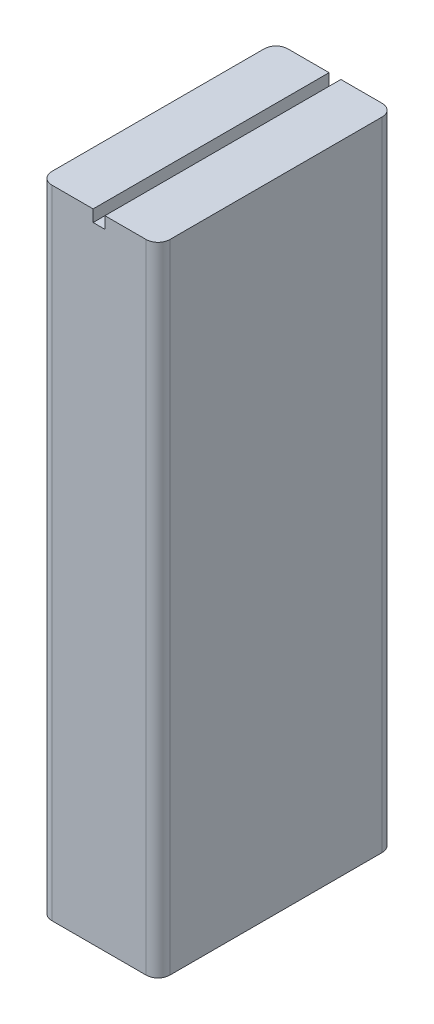
from build123d import *

# Parameters (mm, degrees)
SKETCH_1_W          = 10
SKETCH_1_H          = 20
EXTRUDE_1_DEPTH     = 54
FILLET_1_R          = 1
SKETCH_2_W          = 1
SKETCH_2_H          = 20
CUT_EXTRUDE_1_DEPTH = 1


with BuildPart() as part:
    # 草图1 → 凸台-拉伸1 (new body)
    with BuildSketch(Plane(origin=(0, 0, 0), x_dir=(1, 0, 0), z_dir=(0, 1, 0))):
        with Locations((5, 10)):
            Rectangle(SKETCH_1_W, SKETCH_1_H)
    extrude(amount=EXTRUDE_1_DEPTH)

    # 圆角1
    fillet_1_edges = [part.edges().sort_by_distance(p)[0] for p in [
        (0, 27, -20),
        (10, 27, -20),
        (10, 27, 0),
        (0, 27, 0),
    ]]
    fillet(fillet_1_edges, radius=FILLET_1_R)

    # 草图2 → 切除-拉伸1 (cut)
    with BuildSketch(Plane(origin=(0, 54, 0), x_dir=(1, 0, 0), z_dir=(0, 1, 0))):
        with Locations((5, 10)):
            Rectangle(SKETCH_2_W, SKETCH_2_H)
    extrude(amount=-CUT_EXTRUDE_1_DEPTH, mode=Mode.SUBTRACT)


solid = part.part
